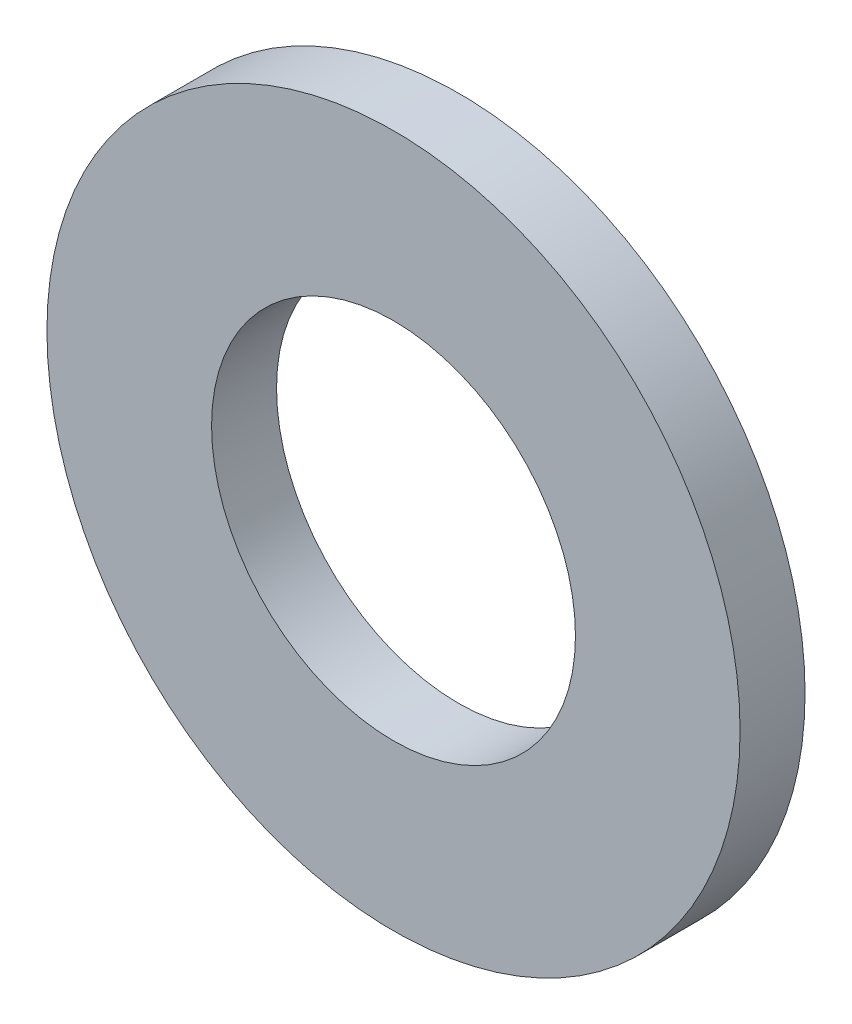
from build123d import *

# Parameters (mm, degrees)
ESQUISSE1_R             = 8
BOSS_EXTRU_1_DEPTH      = 1.5
ESQUISSE2_R             = 4.2
ENL_V_MAT_EXTRU_1_DEPTH = 1.5


with BuildPart() as part:
    # Esquisse1 → Boss.-Extru.1 (new body)
    with BuildSketch(Plane.XY):
        Circle(ESQUISSE1_R)
    extrude(amount=BOSS_EXTRU_1_DEPTH)

    # Esquisse2 → Enlèv. mat.-Extru.1 (cut)
    with BuildSketch(Plane.XY.offset(1.5)):
        Circle(ESQUISSE2_R)
    extrude(amount=-ENL_V_MAT_EXTRU_1_DEPTH, mode=Mode.SUBTRACT)


solid = part.part
